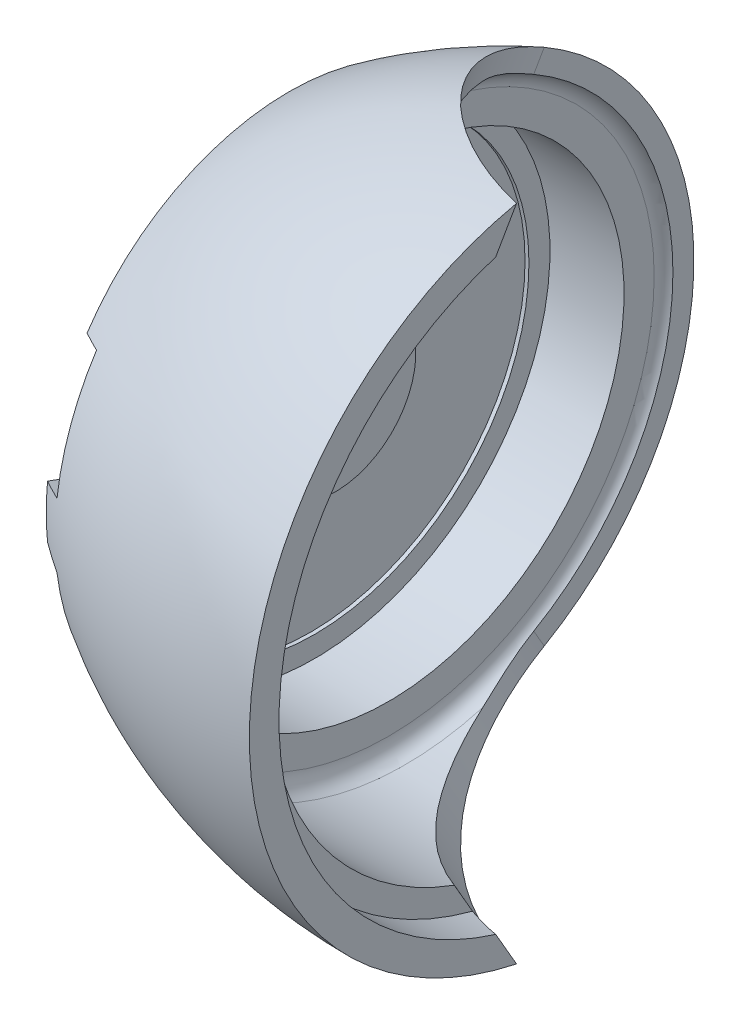
from build123d import *

# Parameters (mm, degrees)
FILLET1_R          = 2.54
SKETCH9_R          = 35.052
CUT_EXTRUDE4_DEPTH = 57.912
SKETCH10_W         = 58.015232171
SKETCH10_H         = 28.829548031
CUT_REVOLVE2_ANGLE = 120
CUT_EXTRUDE5_START = -31.75
SKETCH11_W         = 5.08
SKETCH11_H         = 17.78
CUT_EXTRUDE5_DEPTH = 31.75
FILLET2_R          = 2.54


with BuildPart() as part:
    # Sketch1 → Revolve1 (revolve)
    with BuildSketch(Plane.XY, mode=Mode.PRIVATE) as revolve1_sk:
        with BuildLine():
            Line((-39.088, 0), (-39.088, 12.4))
            Line((-39.088, 12.4), (-42.39, 12.4))
            Line((-42.39, 12.4), (-42.9, 12.4))
            Line((-42.9, 12.4), (-42.9, 33.02))
            Line((-42.9, 33.02), (-42.3, 33.02))
            Line((-42.3, 33.02), (-42.3, 36.2585))
            Line((-42.3, 36.2585), (-30.9, 36.2585))
            Line((-30.9, 36.2585), (-30.9, 43.434))
            Line((-30.9, 43.434), (-5.909999996, 43.434))
            Line((-5.909999996, 43.434), (-5.909999996, 47.244))
            Line((-5.909999996, 47.244), (-0.509999996, 47.244))
            Line((-0.509999996, 47.244), (-0.509999996, 51.81439996))
            ThreePointArc((-0.509999996, 51.81439996), (-24.440435702, 48.054407509), (-46.2, 37.409002026))
            Line((-46.2, 37.409002026), (-46.2, 8.59))
            Line((-46.2, 8.59), (-42.988, 8.59))
            Line((-42.988, 8.59), (-42.988, 0))
            Line((-42.988, 0), (-39.088, 0))
        make_face()
    revolve(revolve1_sk.sketch.rotate(Axis((-42.988, 0, 0), (1, 0, 0)), 90), axis=Axis((-42.988, 0, 0), (1, 0, 0)))

    # Fillet1
    fillet1_edges = [part.edges().sort_by_distance(p)[0] for p in [
        (-30.9, 0, -43.434),
    ]]
    fillet(fillet1_edges, radius=FILLET1_R)

    # Sketch9 → Cut-Extrude4 (cut)
    with BuildSketch(Plane(origin=(0, 0, 0), x_dir=(1, 0, 0), z_dir=(0, -0.8660254037844416, 0.49999999999999495))):
        with Locations((5.08, 0)):
            Circle(SKETCH9_R)
    cut_extrude4 = extrude(amount=-CUT_EXTRUDE4_DEPTH, mode=Mode.SUBTRACT)

    # Mirror3: Cut-Extrude4 across plane
    add(cut_extrude4.mirror(Plane.ZX), mode=Mode.SUBTRACT)

    # Sketch10 → Cut-Revolve2 (revolve, cut)
    with BuildSketch(Plane(origin=(0, 0, 0), x_dir=(1, 0, 0), z_dir=(0, -0.49999999999999495, -0.8660254037844416))):
        with Locations((-0.964383914, -42.303173001)):
            Rectangle(SKETCH10_W, SKETCH10_H)
    revolve(axis=Axis((-48.7934, 0, 0), (-1, 0, 0)), revolution_arc=CUT_REVOLVE2_ANGLE, mode=Mode.SUBTRACT)

    # Sketch11 → Cut-Extrude5 (cut)
    with BuildSketch(Plane(origin=(0, 0, 0), x_dir=(1, 0, 0), z_dir=(0, -0.34202014332565933, -0.9396926207859118)).offset(CUT_EXTRUDE5_START)):
        with Locations((-44.84, 0)):
            Rectangle(SKETCH11_W, SKETCH11_H)
    cut_extrude5 = extrude(amount=-CUT_EXTRUDE5_DEPTH, mode=Mode.SUBTRACT)

    # Fillet2
    fillet2_edges = [part.edges().sort_by_distance(p)[0] for p in [
        (-42.9, 10.859139551, 29.83524071),
    ]]
    fillet(fillet2_edges, radius=FILLET2_R)

    # Mirror4: Cut-Extrude5 across plane
    add(cut_extrude5.mirror(Plane.ZX), mode=Mode.SUBTRACT)


solid = part.part
